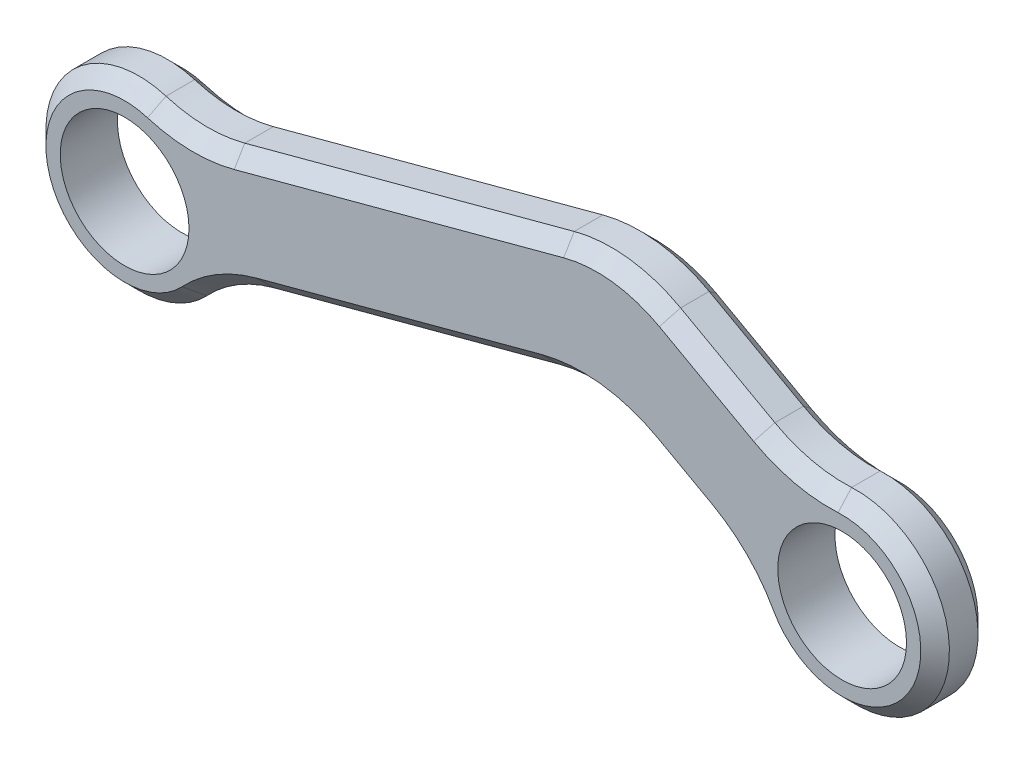
from build123d import *

# Parameters (mm, degrees)
SKETCH1_R           = 4.5
BOSS_EXTRUDE1_DEPTH = 4
FILLET1_R           = 10
CHAMFER2_SIZE       = 1


with BuildPart() as part:
    # Sketch1 → Boss-Extrude1 (new body)
    with BuildSketch(Plane.XY):
        with BuildLine():
            Line((5.984173373, -2.537650299), (33.282244564, 4.776845831))
            Line((33.282244564, 4.776845831), (43.739940984, -1.016288457))
            ThreePointArc((43.739940984, -1.016288457), (55.845872024, -3.149739565), (47.616543526, 5.98170788))
            Line((47.616543526, 5.98170788), (34.332563277, 13.340487326))
            Line((34.332563277, 13.340487326), (3.913621012, 5.189756311))
            ThreePointArc((3.913621012, 5.189756311), (-6.278517871, -1.682323793), (5.984173373, -2.537650299))
        make_face()
        Circle(SKETCH1_R, mode=Mode.SUBTRACT)
        with Locations((50.16, 0)):
            Circle(SKETCH1_R, mode=Mode.SUBTRACT)
    extrude(amount=BOSS_EXTRUDE1_DEPTH)

    # Fillet1
    fillet1_edges = [part.edges().sort_by_distance(p)[0] for p in [
        (33.282244564, 4.776845831, 2),
        (5.984173373, -2.537650299, 2),
        (3.913621012, 5.189756311, 2),
        (34.332563277, 13.340487326, 2),
        (47.616543526, 5.98170788, 2),
        (43.739940984, -1.016288457, 2),
    ]]
    fillet(fillet1_edges, radius=FILLET1_R)

    # Chamfer2
    chamfer2_edges = [part.edges().sort_by_distance(p)[0] for p in [
        (38.699188042, 1.776081634, 0),
        (38.699188042, 1.776081634, 4),
        (19.425508285, 1.063944536, 0),
        (19.425508285, 1.063944536, 4),
        (18.915391461, 9.209468588, 0),
        (18.915391461, 9.209468588, 4),
        (-6.278517871, -1.682323793, 0),
        (41.16264867, 9.55690055, 0),
        (55.845872024, -3.149739565, 0),
        (34.237028938, 12.561560111, 0),
        (41.16264867, 9.55690055, 4),
        (55.845872024, -3.149739565, 4),
        (-6.278517871, -1.682323793, 4),
        (34.237028938, 12.561560111, 4),
        (33.186710225, 3.997918617, 0),
        (33.186710225, 3.997918617, 4),
        (6.91120565, -2.689125301, 0),
        (6.91120565, -2.689125301, 4),
        (47.054714022, 6.734490138, 0),
        (47.054714022, 6.734490138, 4),
        (42.803779737, -0.939245365, 0),
        (42.803779737, -0.939245365, 4),
        (4.640717013, 5.784453649, 0),
        (4.640717013, 5.784453649, 4),
    ]]
    chamfer(chamfer2_edges, length=CHAMFER2_SIZE)


solid = part.part
